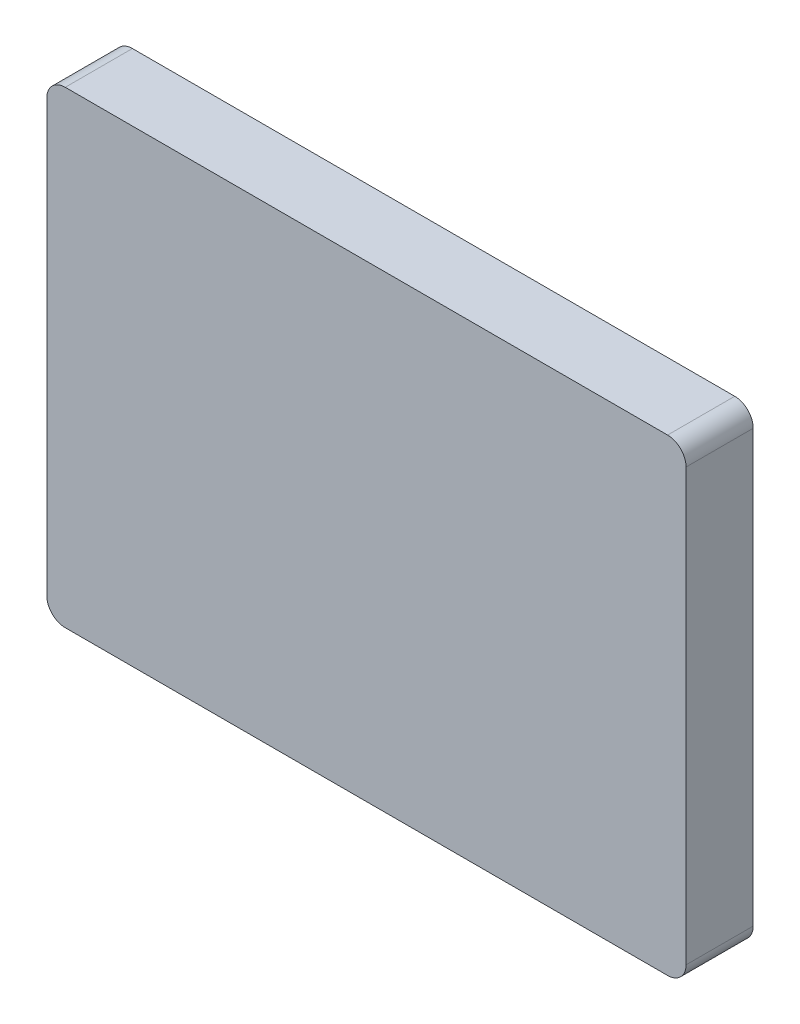
from build123d import *

# Parameters (mm, degrees)
BOSS_EXTRUDE1_DEPTH = 10


with BuildPart() as part:
    # Sketch2 → Boss-Extrude1 (new body)
    with BuildSketch(Plane.XY):
        with BuildLine():
            Line((-47.6, 32.276554225), (-47.6, -31.923445775))
            ThreePointArc((-47.6, -31.923445775), (-46.794543648, -33.867989423), (-44.85, -34.673445775))
            Line((-44.85, -34.673445775), (44.85, -34.673445775))
            ThreePointArc((44.85, -34.673445775), (46.794543648, -33.867989423), (47.6, -31.923445775))
            Line((47.6, -31.923445775), (47.6, 32.276554225))
            ThreePointArc((47.6, 32.276554225), (46.794543648, 34.221097873), (44.85, 35.026554225))
            Line((44.85, 35.026554225), (-44.85, 35.026554225))
            ThreePointArc((-44.85, 35.026554225), (-46.794543648, 34.221097873), (-47.6, 32.276554225))
        make_face()
    extrude(amount=BOSS_EXTRUDE1_DEPTH)


solid = part.part
